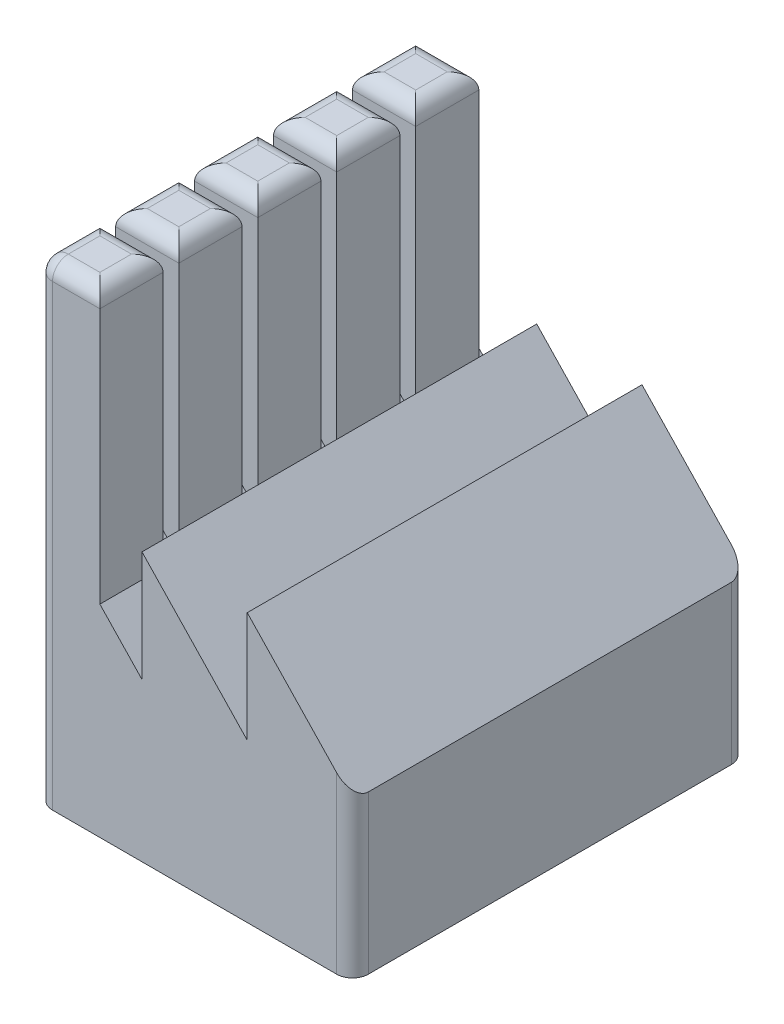
from build123d import *

# Parameters (mm, degrees)
EXTRUDE_1_DEPTH        = 25
SKETCH_2_W             = 4
SKETCH_2_H             = 4
EXTRUDE_2_DEPTH        = 30
PATTERN_LINEAR_1_COUNT = 5
PATTERN_LINEAR_1_PITCH = 5
FILLET_1_R             = 1


with BuildPart() as part:
    # 草图1 → 凸台-拉伸1 (new body)
    with BuildSketch(Plane.XY):
        Polygon((-10, 5), (-10, 12), (-3.333333333, 5), (-3.333333333, 12), (3.333333333, 5), (3.333333333, 12), (10, 5), (10, -5), (-10, -5), align=None)
    extrude(amount=EXTRUDE_1_DEPTH)

    # 草图2 → 凸台-拉伸2 (add)
    with BuildSketch(Plane.XZ.offset(5)):
        with Locations((-8, 23)):
            Rectangle(SKETCH_2_W, SKETCH_2_H)
    extrude_2 = extrude(amount=-EXTRUDE_2_DEPTH)

    # 阵列(线性)1: 凸台-拉伸2 ×5
    with Locations(*[(0, 0, -i * PATTERN_LINEAR_1_PITCH) for i in range(1, PATTERN_LINEAR_1_COUNT)]):
        add(extrude_2)

    # 圆角1
    fillet_1_edges = [part.edges().sort_by_distance(p)[0] for p in [
        (-10, 25, 3),
        (-8, 25, 5),
        (-6, 25, 3),
        (-8, 25, 1),
        (-10, 10, 25),
        (10, 0, 25),
        (-8, 25, 25),
        (-8, 25, 21),
        (-10, 25, 23),
        (-6, 25, 23),
        (-10, 25, 18),
        (-8, 25, 20),
        (-6, 25, 18),
        (-8, 25, 16),
        (-10, 25, 13),
        (-8, 25, 15),
        (-6, 25, 13),
        (-8, 25, 11),
        (10, 0, 0),
        (-10, 25, 8),
        (-8, 25, 10),
        (-6, 25, 8),
        (-8, 25, 6),
        (-10, 3.5, 0),
    ]]
    fillet(fillet_1_edges, radius=FILLET_1_R)


solid = part.part
